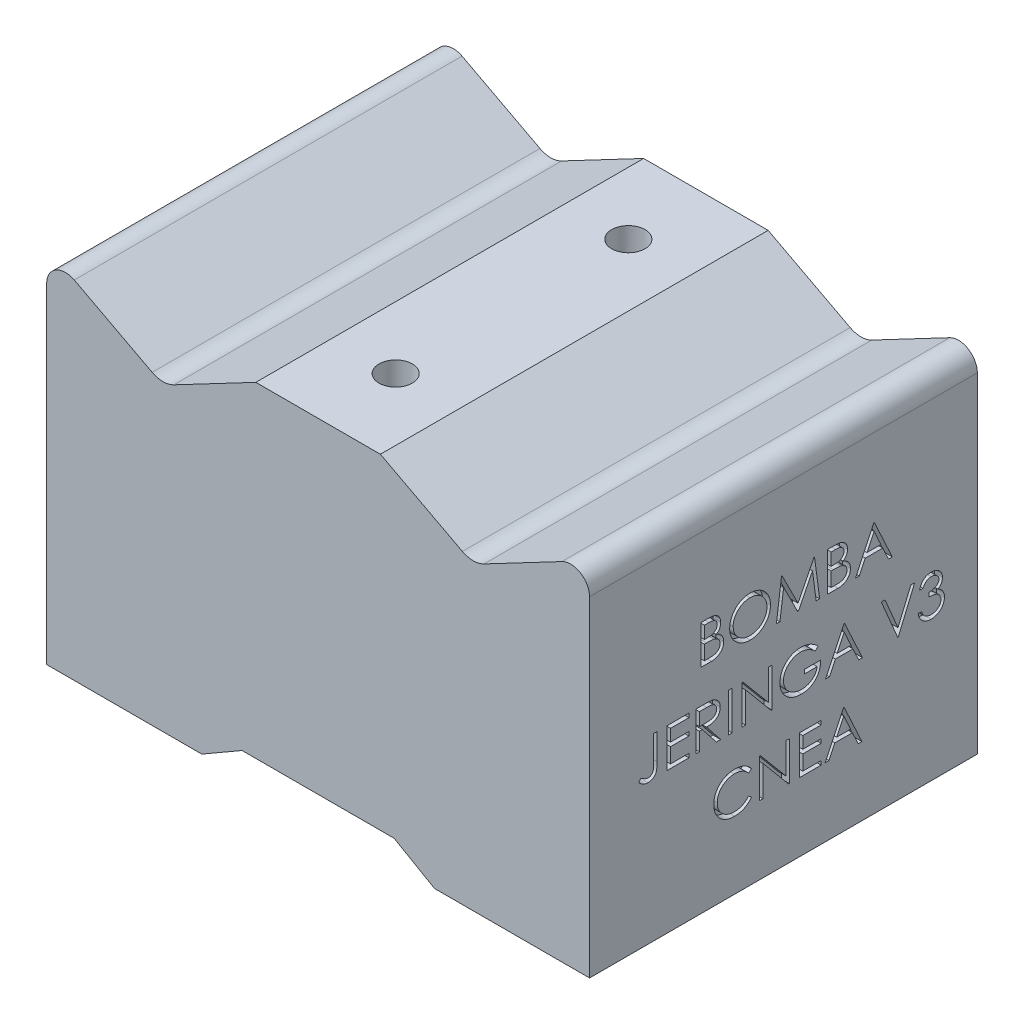
from build123d import *

# Parameters (mm, degrees)
SALIENTE_EXTRUIR1_DEPTH                              = 25
REDONDEO1_R                                          = 3
REDONDEO3_R                                          = 2.429028
REDONDEO1_OF_SIMETR_A1_R                             = 3
REDONDEO3_OF_SIMETR_A1_R                             = 2.429028
DI_METRO_DE_TALADRO_5_5_5_5_1_D                      = 5.5
DI_METRO_DE_TALADRO_5_5_5_5_1_DEPTH                  = 7
TALADRO_DE_MARGEN_PARA_M43_D                         = 5.5
TALADRO_DE_MARGEN_PARA_M43_DEPTH                     = 7
TALADRO_DE_MARGEN_PARA_M43_TIP                       = 2.75
REFRENTADO_PARA_TORNILLO_CON_CABEZA_HUEC_D           = 4.3
REFRENTADO_PARA_TORNILLO_CON_CABEZA_HUEC_CBORE_D     = 8
REFRENTADO_PARA_TORNILLO_CON_CABEZA_HUEC_CBORE_DEPTH = 37.4
CROQUIS28_W                                          = 0.448717949
CROQUIS28_H                                          = 5
CORTAR_EXTRUIR1_DEPTH                                = 1


with BuildPart() as part:
    # Croquis2 → Saliente-Extruir1 (new, symmetric)
    with BuildSketch(Plane.XY):
        Polygon((-35, 45), (-35, 0), (-15, 0), (-9.803847577, 3), (0, 3), (0, 45), (-8.029229647, 45), (-20, 38.699473768), (-31.970770353, 45), align=None)
    saliente_extruir1 = extrude(amount=SALIENTE_EXTRUIR1_DEPTH, both=True)

    # Croquis21 → Diámetro de taladro Ø8.6 (8.6)1 (revolve, cut)
    with BuildSketch(Plane(origin=(-22, 20, -25), x_dir=(0, 1, 0), z_dir=(1, 0, 0))):
        Polygon((0, 0), (0, 16.3), (4.3, 12), (4.3, 0), align=None)
    di_metro_de_taladro_8_6_8_6_1 = revolve(axis=Axis((-22, 20, -31.35), (0, 0, 1)), mode=Mode.SUBTRACT)

    # Redondeo1
    redondeo1_edges = [part.edges().sort_by_distance(p)[0] for p in [
        (-20, 38.699473768, 0),
    ]]
    fillet(redondeo1_edges, radius=REDONDEO1_R)

    # Redondeo3
    redondeo3_edges = [part.edges().sort_by_distance(p)[0] for p in [
        (-35, 45, 0),
        (-31.970770353, 45, 0),
    ]]
    fillet(redondeo3_edges, radius=REDONDEO3_R)

    # Simetría1: Saliente-Extruir1, Diámetro de taladro Ø8.6 (8.6)1 across plane
    add(saliente_extruir1.mirror(Plane(origin=(0, 0, 0), x_dir=(0, 0, 1), z_dir=(1, 0, 0))))
    add(di_metro_de_taladro_8_6_8_6_1.mirror(Plane(origin=(0, 0, 0), x_dir=(0, 0, 1), z_dir=(1, 0, 0))), mode=Mode.SUBTRACT)

    # Redondeo1 of Simetría1
    redondeo1_of_simetr_a1_edges = [part.edges().sort_by_distance(p)[0] for p in [
        (20, 38.699473768, 0),
    ]]
    fillet(redondeo1_of_simetr_a1_edges, radius=REDONDEO1_OF_SIMETR_A1_R)

    # Redondeo3 of Simetría1
    redondeo3_of_simetr_a1_edges = [part.edges().sort_by_distance(p)[0] for p in [
        (35, 45, 0),
        (31.970770353, 45, 0),
    ]]
    fillet(redondeo3_of_simetr_a1_edges, radius=REDONDEO3_OF_SIMETR_A1_R)

    # Diámetro de taladro Ø5.5 (5.5)1
    with Locations(Plane(origin=(0, 0, 0), x_dir=(-1, 0, 0), z_dir=(0, -1, 0))):
        with Locations((25, 15)):
            di_metro_de_taladro_5_5_5_5_1 = Hole(DI_METRO_DE_TALADRO_5_5_5_5_1_D / 2, depth=DI_METRO_DE_TALADRO_5_5_5_5_1_DEPTH)

    # Matriz de croquis1: Diámetro de taladro Ø5.5 (5.5)1 at 3 more places
    with Locations((50, 0, 30), (50, 0, 0), (0, 0, 30)):
        add(di_metro_de_taladro_5_5_5_5_1, mode=Mode.SUBTRACT)

    # Taladro de margen para M43
    with Locations(Plane(origin=(0, 0, -25), x_dir=(-1, 0, 0), z_dir=(0, 0, -1))):
        with Locations((-18.25, 30), (18.25, 30)):
            Hole(TALADRO_DE_MARGEN_PARA_M43_D / 2, depth=TALADRO_DE_MARGEN_PARA_M43_DEPTH)
            with Locations((0, 0, -(TALADRO_DE_MARGEN_PARA_M43_DEPTH + TALADRO_DE_MARGEN_PARA_M43_TIP / 2))):  # 90° drill point
                Cone(0, TALADRO_DE_MARGEN_PARA_M43_D / 2, TALADRO_DE_MARGEN_PARA_M43_TIP, mode=Mode.SUBTRACT)

    # Refrentado para tornillo con cabeza hueca de M41 (through all)
    with Locations(Plane(origin=(0, 3, 0), x_dir=(-1, 0, 0), z_dir=(0, -1, 0))):
        with Locations((0, 15), (0, -15)):
            CounterBoreHole(REFRENTADO_PARA_TORNILLO_CON_CABEZA_HUEC_D / 2, REFRENTADO_PARA_TORNILLO_CON_CABEZA_HUEC_CBORE_D / 2, REFRENTADO_PARA_TORNILLO_CON_CABEZA_HUEC_CBORE_DEPTH)

    # Croquis28 → Cortar-Extruir1 (cut)
    # profile 1 of 18: a face of its own
    with BuildSketch(Plane(origin=(35, 0, 0), x_dir=(0, 0, -1), z_dir=(1, 0, 0))):
        with BuildLine():
            Line((-10.649410219, 32.506300776), (-9.673849322, 32.506300776))
            add(Edge.make_bspline(
                [(-9.673849322, 32.506300776), (-9.626094353, 32.506049704), (-9.533533338, 32.505563064), (-9.398934135, 32.498015734), (-9.272864406, 32.487724777), (-9.155287588, 32.471396073), (-9.046258013, 32.451693534), (-8.945447103, 32.427833797), (-8.853175428, 32.399224349), (-8.743014376, 32.353729662), (-8.617413432, 32.286125135), (-8.481415728, 32.186227185), (-8.365123958, 32.064037952), (-8.26485779, 31.926205587), (-8.185141905, 31.774583056), (-8.12747148, 31.612784215), (-8.09096023, 31.442896012), (-8.087205324, 31.326262901), (-8.085307655, 31.267318404)],
                knots=[0, 0, 0, 0, 1.001505555, 1.941167018, 2.826882275, 3.653841531, 4.429895133, 5.150066043, 5.825578002, 6.45369114, 7.647487171, 8.808567382, 9.977351308, 11.170798116, 12.373658725, 13.556498008, 14.765093433, 16, 16, 16, 16], degree=3))
            add(Edge.make_bspline(
                [(-8.085307655, 31.267318404), (-8.086869395, 31.212100468), (-8.089938363, 31.103592015), (-8.119285162, 30.944886144), (-8.165228974, 30.793812975), (-8.229093616, 30.650923853), (-8.312096468, 30.519447262), (-8.410465494, 30.398322597), (-8.529146641, 30.292678229), (-8.618065555, 30.23361694), (-8.663232334, 30.203616481)],
                knots=[0, 0, 0, 0, 1.044552857, 2.05264487, 3.044412934, 4.028983338, 5.005914585, 5.980388656, 6.974128949, 8, 8, 8, 8], degree=3))
            add(Edge.make_bspline(
                [(-8.663232334, 30.203616481), (-8.606431723, 30.18180934), (-8.497758084, 30.140086876), (-8.348206638, 30.066321928), (-8.219356859, 29.986090342), (-8.110218079, 29.898473413), (-8.016878572, 29.804032255), (-7.93537437, 29.701382091), (-7.86582955, 29.589183866), (-7.806239659, 29.468607387), (-7.759741436, 29.340883861), (-7.724918716, 29.207211323), (-7.704965217, 29.068069102), (-7.702125729, 28.973375702), (-7.70069227, 28.925571609)],
                knots=[0, 0, 0, 0, 1.27268992, 2.434971085, 3.483601985, 4.442670788, 5.356604649, 6.2567628, 7.179492994, 8.113709626, 9.066344395, 10.018646069, 10.999752585, 12, 12, 12, 12], degree=3))
            add(Edge.make_bspline(
                [(-7.70069227, 28.925571609), (-7.702087765, 28.876761792), (-7.704833439, 28.780727109), (-7.725090541, 28.639648345), (-7.759389266, 28.504826993), (-7.80663376, 28.375391018), (-7.86829421, 28.251590826), (-7.943334159, 28.133286163), (-8.032807821, 28.021665691), (-8.132897634, 27.915489086), (-8.24612927, 27.820020819), (-8.368294635, 27.73499838), (-8.500932234, 27.665075435), (-8.641863654, 27.606338261), (-8.79266982, 27.561470835), (-8.952673545, 27.530081443), (-9.121736833, 27.50893139), (-9.237750764, 27.507192526), (-9.297246757, 27.506300776)],
                knots=[0, 0, 0, 0, 0.978564426, 1.925352924, 2.850884081, 3.763762016, 4.682927383, 5.618979971, 6.567305752, 7.547517671, 8.540179244, 9.531824382, 10.526200242, 11.540722885, 12.589160233, 13.674978461, 14.80764778, 16, 16, 16, 16], degree=3))
            Line((-9.297246757, 27.506300776), (-10.649410219, 27.506300776))
            Line((-10.649410219, 27.506300776), (-10.649410219, 32.506300776))
        make_face()
        with BuildLine():
            Line((-10.20069227, 31.993480263), (-10.20069227, 30.390916161))
            Line((-10.20069227, 30.390916161), (-9.899209898, 30.390916161))
            add(Edge.make_bspline(
                [(-9.899209898, 30.390916161), (-9.855140191, 30.391487479), (-9.769988535, 30.392591383), (-9.646674397, 30.39575355), (-9.532210085, 30.404607898), (-9.426793181, 30.413459701), (-9.330589689, 30.427851969), (-9.243812744, 30.444983573), (-9.165100463, 30.463102009), (-9.074329684, 30.493915562), (-8.971368329, 30.539455098), (-8.861606751, 30.61012915), (-8.764843223, 30.694306797), (-8.683132955, 30.791436742), (-8.616259426, 30.898388436), (-8.569811261, 31.013455408), (-8.538315141, 31.133769883), (-8.535470096, 31.216367387), (-8.534025604, 31.258303981)],
                knots=[0, 0, 0, 0, 1.156816544, 2.235205308, 3.236616184, 4.169592532, 5.011045266, 5.787822928, 6.49130361, 7.128639758, 8.301311294, 9.436451833, 10.541879658, 11.654887649, 12.756523258, 13.837046038, 14.901820046, 16, 16, 16, 16], degree=3))
            add(Edge.make_bspline(
                [(-8.534025604, 31.258303981), (-8.53477729, 31.286055083), (-8.536251804, 31.340491901), (-8.54832795, 31.419848121), (-8.568853057, 31.494482053), (-8.595216333, 31.565416496), (-8.632057317, 31.630433425), (-8.675433693, 31.691780848), (-8.727841822, 31.747369588), (-8.787495125, 31.799326015), (-8.856078872, 31.845389626), (-8.933552146, 31.885733573), (-9.020963114, 31.918220397), (-9.116838621, 31.946672043), (-9.22265446, 31.96665532), (-9.337189536, 31.983303017), (-9.461381992, 31.991778363), (-9.547303567, 31.99290031), (-9.591717911, 31.993480263)],
                knots=[0, 0, 0, 0, 0.91205012, 1.789085906, 2.630437955, 3.453916878, 4.269457761, 5.079663411, 5.91843418, 6.774407191, 7.675494373, 8.627863946, 9.638891023, 10.736472738, 11.911756761, 13.175263542, 14.539845004, 16, 16, 16, 16], degree=3))
            Line((-9.591717911, 31.993480263), (-10.20069227, 31.993480263))
        make_face(mode=Mode.SUBTRACT)
        with BuildLine():
            Line((-10.20069227, 29.878095648), (-10.20069227, 28.019121289))
            Line((-10.20069227, 28.019121289), (-9.561669834, 28.019121289))
            add(Edge.make_bspline(
                [(-9.561669834, 28.019121289), (-9.515928512, 28.0196695), (-9.427768142, 28.020726103), (-9.300480671, 28.024175467), (-9.182504808, 28.032021575), (-9.0743789, 28.044372789), (-8.974935396, 28.057770573), (-8.885367249, 28.075786689), (-8.804948401, 28.096428061), (-8.71169939, 28.128334021), (-8.606694378, 28.177900408), (-8.493536012, 28.252635018), (-8.392927129, 28.341668314), (-8.307491044, 28.444712477), (-8.237472489, 28.55675723), (-8.186536125, 28.675536302), (-8.155120615, 28.799087055), (-8.151317516, 28.883325216), (-8.149410219, 28.925571609)],
                knots=[0, 0, 0, 0, 1.160039823, 2.235823828, 3.228722157, 4.157150951, 4.99529583, 5.772374946, 6.472645482, 7.099169577, 8.269452708, 9.405989375, 10.527446681, 11.663510218, 12.788923519, 13.866172445, 14.929861265, 16, 16, 16, 16], degree=3))
            add(Edge.make_bspline(
                [(-8.149410219, 28.925571609), (-8.149804654, 28.951990667), (-8.150587161, 29.004402641), (-8.162388039, 29.08142524), (-8.179550711, 29.156033631), (-8.201738473, 29.228430403), (-8.234051998, 29.297306655), (-8.271775633, 29.364024597), (-8.316006207, 29.428672425), (-8.384926444, 29.510404215), (-8.485172136, 29.604571377), (-8.627610387, 29.696767808), (-8.789570813, 29.771121818), (-8.90703866, 29.802692499), (-8.967719514, 29.819001097)],
                knots=[0, 0, 0, 0, 0.723448775, 1.435228256, 2.130040452, 2.821711965, 3.505591119, 4.210454504, 4.921174351, 5.648778258, 7.137944449, 8.670945889, 10.280296675, 12, 12, 12, 12], degree=3))
            add(Edge.make_bspline(
                [(-8.967719514, 29.819001097), (-8.992046794, 29.823936931), (-9.044793354, 29.834638838), (-9.130804183, 29.845935557), (-9.228998282, 29.855999928), (-9.339602392, 29.863444439), (-9.462756451, 29.871139501), (-9.598723477, 29.874132103), (-9.746948213, 29.877702474), (-9.849794459, 29.877961237), (-9.903216309, 29.878095648)],
                knots=[0, 0, 0, 0, 0.634451884, 1.375622551, 2.216452059, 3.157844607, 4.20941857, 5.370758133, 6.634282058, 8, 8, 8, 8], degree=3))
            Line((-9.903216309, 29.878095648), (-10.20069227, 29.878095648))
        make_face(mode=Mode.SUBTRACT)
    # profile 2 of 18: a face of its own
    with BuildSketch(Plane(origin=(35, 0, 0), x_dir=(0, 0, -1), z_dir=(1, 0, 0))):
        with BuildLine():
            add(Edge.make_bspline(
                [(-4.335307655, 32.634505904), (-4.242724646, 32.632160934), (-4.060883979, 32.627555218), (-3.793634125, 32.592299356), (-3.538498275, 32.531305942), (-3.293398077, 32.45007311), (-3.061265253, 32.341709702), (-2.84035255, 32.210730919), (-2.631185587, 32.055764549), (-2.436583613, 31.878008511), (-2.258502256, 31.684603576), (-2.101608133, 31.478206562), (-1.970119141, 31.260065416), (-1.862139446, 31.030835658), (-1.777427146, 30.791035704), (-1.718971369, 30.539387128), (-1.681631155, 30.277520428), (-1.677265758, 30.098910621), (-1.675051245, 30.008303981)],
                knots=[0, 0, 0, 0, 1.065120563, 2.091984664, 3.0946048, 4.079830382, 5.057816894, 6.036188127, 7.030412546, 8.04752943, 9.064399622, 10.05169764, 11.02544977, 11.989514704, 12.962713494, 13.945757189, 14.957906945, 16, 16, 16, 16], degree=3))
            add(Edge.make_bspline(
                [(-1.675051245, 30.008303981), (-1.677265434, 29.918364772), (-1.681629858, 29.741084172), (-1.719013825, 29.480879251), (-1.777643825, 29.230749685), (-1.861352777, 28.991113038), (-1.968817746, 28.761716518), (-2.101182277, 28.543163727), (-2.257098292, 28.335383015), (-2.434536651, 28.140650636), (-2.627966711, 27.962082821), (-2.83543852, 27.806484427), (-3.05228612, 27.672592821), (-3.281299989, 27.565759001), (-3.519442899, 27.480370543), (-3.768846217, 27.4221525), (-4.028341295, 27.384599581), (-4.205299871, 27.380287415), (-4.295243552, 27.378095648)],
                knots=[0, 0, 0, 0, 1.043624062, 2.057103931, 3.04512605, 4.022047818, 4.998200453, 5.980619268, 6.982898556, 8.009068085, 9.034988726, 10.034168286, 11.015286542, 11.987931943, 12.962482838, 13.94673481, 14.956375938, 16, 16, 16, 16], degree=3))
            add(Edge.make_bspline(
                [(-4.295243552, 27.378095648), (-4.385849722, 27.380309058), (-4.564458602, 27.384672278), (-4.826654367, 27.422074284), (-5.078479715, 27.480561861), (-5.319214503, 27.56414677), (-5.548992974, 27.672171386), (-5.76826452, 27.803891927), (-5.976149016, 27.960187843), (-6.17092294, 28.137568664), (-6.34913608, 28.330670881), (-6.504506617, 28.53757696), (-6.636256779, 28.754227612), (-6.743918682, 28.981224075), (-6.829153624, 29.217468993), (-6.887303364, 29.464538247), (-6.924926153, 29.721023255), (-6.929261648, 29.895655967), (-6.931461501, 29.98426552)],
                knots=[0, 0, 0, 0, 1.053102029, 2.075944431, 3.073151272, 4.055350789, 5.033113405, 6.020478099, 7.024410459, 8.052272461, 9.079885166, 10.07527673, 11.055994387, 12.023226415, 12.992069828, 13.970394897, 14.97016774, 16, 16, 16, 16], degree=3))
            add(Edge.make_bspline(
                [(-6.931461501, 29.98426552), (-6.930697736, 30.043740761), (-6.929179841, 30.161940938), (-6.910905995, 30.337464652), (-6.884389279, 30.510165592), (-6.846386547, 30.67955266), (-6.796684165, 30.84521121), (-6.738038412, 31.008283728), (-6.666410061, 31.167117619), (-6.585437707, 31.322465322), (-6.495063695, 31.471905187), (-6.395241196, 31.613161735), (-6.289476384, 31.747420302), (-6.173528679, 31.871201736), (-6.051219472, 31.988106959), (-5.920564646, 32.096339412), (-5.782361439, 32.196875056), (-5.636015183, 32.287475543), (-5.485131933, 32.369417164), (-5.329593679, 32.439734094), (-5.171512862, 32.500085611), (-5.01014908, 32.549001075), (-4.845930834, 32.58761827), (-4.678499713, 32.613914489), (-4.507989104, 32.632234943), (-4.393115791, 32.63374566), (-4.335307655, 32.634505904)],
                knots=[0, 0, 0, 0, 1.037015668, 2.060948919, 3.074880161, 4.083647147, 5.086022904, 6.090072063, 7.104153813, 8.122640571, 9.144368836, 10.147691507, 11.138137339, 12.123020368, 13.103399296, 14.087645067, 15.080126199, 16.082011238, 17.087798457, 18.072939717, 19.057185487, 20.037253025, 21.01195951, 21.997135196, 22.992090687, 24, 24, 24, 24], degree=3))
        make_face()
        with BuildLine():
            add(Edge.make_bspline(
                [(-4.313272398, 32.121685392), (-4.360721875, 32.121106977), (-4.455167208, 32.119955677), (-4.595573688, 32.104790369), (-4.734133594, 32.083176242), (-4.870875539, 32.052345498), (-5.005227381, 32.010339709), (-5.13844144, 31.961995554), (-5.269302946, 31.903108282), (-5.397379886, 31.836575847), (-5.521544279, 31.762934531), (-5.638705281, 31.681546293), (-5.749166201, 31.594319787), (-5.852656582, 31.501051448), (-5.948872542, 31.401266302), (-6.03970783, 31.296477108), (-6.121521518, 31.183688692), (-6.196500913, 31.065959539), (-6.263597828, 30.943442995), (-6.32326262, 30.817428906), (-6.372068347, 30.686889353), (-6.411871742, 30.553240557), (-6.444871472, 30.416694186), (-6.465777078, 30.276214402), (-6.48110902, 30.132507099), (-6.482194513, 30.035390164), (-6.482743552, 29.986268725)],
                knots=[0, 0, 0, 0, 1.008559885, 2.007477868, 2.99961109, 3.989939068, 4.984837346, 5.991145699, 7.001802488, 8.033829008, 9.059044045, 10.069351652, 11.065060232, 12.050310815, 13.029377138, 14.011219647, 14.996725999, 15.989392538, 16.977580475, 17.965360261, 18.951710183, 19.937753436, 20.929683414, 21.935841486, 22.955955122, 24, 24, 24, 24], degree=3))
            add(Edge.make_bspline(
                [(-6.482743552, 29.986268725), (-6.480922321, 29.914036981), (-6.477339395, 29.771934795), (-6.445971438, 29.563694589), (-6.397654332, 29.363568466), (-6.326429523, 29.172651453), (-6.237357216, 28.989302477), (-6.127318801, 28.815148042), (-5.996948679, 28.650141078), (-5.848857927, 28.495433551), (-5.686968346, 28.35422526), (-5.515064446, 28.230277533), (-5.334987864, 28.125405747), (-5.146269003, 28.03996993), (-4.949915376, 27.972270304), (-4.744661731, 27.92587226), (-4.53187536, 27.895335895), (-4.386831567, 27.892403387), (-4.313272398, 27.890916161)],
                knots=[0, 0, 0, 0, 1.032063989, 2.030389145, 3.003944642, 3.970395727, 4.937377036, 5.913328081, 6.909231446, 7.93887556, 8.970685674, 9.976071282, 10.964166581, 11.944589148, 12.933237628, 13.927779006, 14.949070134, 16, 16, 16, 16], degree=3))
            add(Edge.make_bspline(
                [(-4.313272398, 27.890916161), (-4.263830253, 27.891595453), (-4.16577163, 27.892942693), (-4.019920884, 27.906512231), (-3.876697724, 27.928272044), (-3.736303039, 27.959601552), (-3.598896165, 27.998811847), (-3.463903589, 28.045394316), (-3.332763174, 28.103510321), (-3.203820549, 28.167721681), (-3.080397347, 28.240921906), (-2.962575158, 28.319547834), (-2.853323758, 28.406645863), (-2.749910799, 28.498528453), (-2.653299814, 28.597048235), (-2.564144123, 28.702077124), (-2.482743934, 28.814278062), (-2.40779301, 28.931828642), (-2.340931206, 29.054680432), (-2.28267535, 29.1811514), (-2.233252328, 29.310930128), (-2.193354464, 29.444203801), (-2.162089518, 29.5807193), (-2.140546776, 29.720659411), (-2.125477578, 29.863744186), (-2.124341753, 29.960521123), (-2.123769193, 30.009305584)],
                knots=[0, 0, 0, 0, 1.047197238, 2.076906641, 3.100256066, 4.114471768, 5.12198147, 6.126382909, 7.136867548, 8.15857795, 9.17633901, 10.174870724, 11.156907918, 12.133735059, 13.104061851, 14.077631395, 15.04955518, 16.038496417, 17.029181396, 18.010275684, 18.986308667, 19.968651475, 20.955262928, 21.950658345, 22.966943676, 24, 24, 24, 24], degree=3))
            add(Edge.make_bspline(
                [(-2.123769193, 30.009305584), (-2.124342212, 30.057756304), (-2.1254789, 30.153867233), (-2.140539578, 30.295954116), (-2.162112278, 30.434887276), (-2.193201861, 30.57012128), (-2.233273509, 30.701690601), (-2.282683981, 30.82947167), (-2.340948695, 30.95394052), (-2.407817587, 31.074789515), (-2.482983049, 31.190753427), (-2.565117682, 31.301614016), (-2.655639608, 31.405289361), (-2.751962501, 31.504338924), (-2.856492337, 31.596650195), (-2.968755614, 31.682253796), (-3.08738944, 31.763215616), (-3.212999776, 31.836252133), (-3.342633996, 31.903701037), (-3.475653936, 31.961488184), (-3.610552649, 32.010591212), (-3.746987095, 32.05247259), (-3.886105636, 32.083055491), (-4.026968249, 32.104809848), (-4.169380047, 32.119950399), (-4.265156075, 32.121105225), (-4.313272398, 32.121685392)],
                knots=[0, 0, 0, 0, 1.02996197, 2.043119294, 3.035359645, 4.018872909, 4.991431989, 5.957985074, 6.929999688, 7.912076566, 8.892894881, 9.867085534, 10.843653904, 11.817741046, 12.803660682, 13.806313499, 14.818574707, 15.856120519, 16.894564902, 17.924820532, 18.937903209, 19.946497019, 20.957711757, 21.963978472, 22.977135795, 24, 24, 24, 24], degree=3))
        make_face(mode=Mode.SUBTRACT)
    # profile 3 of 18: a face of its own
    with BuildSketch(Plane(origin=(35, 0, 0), x_dir=(0, 0, -1), z_dir=(1, 0, 0))):
        Polygon((-0.905820475, 27.506300776), (-0.245764386, 32.506300776), (-0.181661822, 32.506300776), (1.882641063, 28.403736674), (3.941935935, 32.506300776), (4.007040102, 32.506300776), (4.671102602, 27.506300776), (4.220381448, 27.506300776), (3.741615422, 31.104057186), (1.936727602, 27.506300776), (1.835565743, 27.506300776), (0.023666704, 31.112070007), (-0.454097719, 27.506300776), align=None)
    # profile 4 of 18: a face of its own
    with BuildSketch(Plane(origin=(35, 0, 0), x_dir=(0, 0, -1), z_dir=(1, 0, 0))):
        with BuildLine():
            Line((5.696743627, 32.506300776), (6.672304525, 32.506300776))
            add(Edge.make_bspline(
                [(6.672304525, 32.506300776), (6.720059493, 32.506049704), (6.812620508, 32.505563064), (6.947219711, 32.498015734), (7.07328944, 32.487724777), (7.190866258, 32.471396073), (7.299895833, 32.451693534), (7.400706743, 32.427833797), (7.492978418, 32.399224349), (7.60313947, 32.353729662), (7.728740414, 32.286125135), (7.864738118, 32.186227185), (7.981029888, 32.064037952), (8.081296056, 31.926205587), (8.161011941, 31.774583056), (8.218682366, 31.612784215), (8.255193616, 31.442896012), (8.258948522, 31.326262901), (8.260846191, 31.267318404)],
                knots=[0, 0, 0, 0, 1.001505555, 1.941167018, 2.826882275, 3.653841531, 4.429895133, 5.150066043, 5.825578002, 6.45369114, 7.647487171, 8.808567382, 9.977351308, 11.170798116, 12.373658725, 13.556498008, 14.765093433, 16, 16, 16, 16], degree=3))
            add(Edge.make_bspline(
                [(8.260846191, 31.267318404), (8.259284451, 31.212100468), (8.256215483, 31.103592015), (8.226868684, 30.944886144), (8.180924872, 30.793812975), (8.11706023, 30.650923853), (8.034057379, 30.519447262), (7.935688352, 30.398322597), (7.817007205, 30.292678229), (7.728088291, 30.23361694), (7.682921512, 30.203616481)],
                knots=[0, 0, 0, 0, 1.044552857, 2.05264487, 3.044412934, 4.028983338, 5.005914585, 5.980388656, 6.974128949, 8, 8, 8, 8], degree=3))
            add(Edge.make_bspline(
                [(7.682921512, 30.203616481), (7.739722123, 30.18180934), (7.848395762, 30.140086876), (7.997947208, 30.066321928), (8.126796987, 29.986090342), (8.235935767, 29.898473413), (8.329275274, 29.804032255), (8.410779476, 29.701382091), (8.480324296, 29.589183866), (8.539914187, 29.468607387), (8.58641241, 29.340883861), (8.62123513, 29.207211323), (8.641188629, 29.068069102), (8.644028117, 28.973375702), (8.645461576, 28.925571609)],
                knots=[0, 0, 0, 0, 1.27268992, 2.434971085, 3.483601985, 4.442670788, 5.356604649, 6.2567628, 7.179492994, 8.113709626, 9.066344395, 10.018646069, 10.999752585, 12, 12, 12, 12], degree=3))
            add(Edge.make_bspline(
                [(8.645461576, 28.925571609), (8.644066082, 28.876761792), (8.641320407, 28.780727109), (8.621063305, 28.639648345), (8.586764581, 28.504826993), (8.539520086, 28.375391018), (8.477859636, 28.251590826), (8.402819687, 28.133286163), (8.313346025, 28.021665691), (8.213256212, 27.915489086), (8.100024576, 27.820020819), (7.977859212, 27.73499838), (7.845221612, 27.665075435), (7.704290192, 27.606338261), (7.553484026, 27.561470835), (7.393480301, 27.530081443), (7.224417013, 27.50893139), (7.108403083, 27.507192526), (7.048907089, 27.506300776)],
                knots=[0, 0, 0, 0, 0.978564426, 1.925352924, 2.850884081, 3.763762016, 4.682927383, 5.618979971, 6.567305752, 7.547517671, 8.540179244, 9.531824382, 10.526200242, 11.540722885, 12.589160233, 13.674978461, 14.80764778, 16, 16, 16, 16], degree=3))
            Line((7.048907089, 27.506300776), (5.696743627, 27.506300776))
            Line((5.696743627, 27.506300776), (5.696743627, 32.506300776))
        make_face()
        with BuildLine():
            Line((6.145461576, 31.993480263), (6.145461576, 30.390916161))
            Line((6.145461576, 30.390916161), (6.446943948, 30.390916161))
            add(Edge.make_bspline(
                [(6.446943948, 30.390916161), (6.491013655, 30.391487479), (6.576165311, 30.392591383), (6.699479449, 30.39575355), (6.813943761, 30.404607898), (6.919360665, 30.413459701), (7.015564157, 30.427851969), (7.102341102, 30.444983573), (7.181053383, 30.463102009), (7.271824163, 30.493915562), (7.374785518, 30.539455098), (7.484547095, 30.61012915), (7.581310623, 30.694306797), (7.663020891, 30.791436742), (7.72989442, 30.898388436), (7.776342585, 31.013455408), (7.807838705, 31.133769883), (7.81068375, 31.216367387), (7.812128243, 31.258303981)],
                knots=[0, 0, 0, 0, 1.156816544, 2.235205308, 3.236616184, 4.169592532, 5.011045266, 5.787822928, 6.49130361, 7.128639758, 8.301311294, 9.436451833, 10.541879658, 11.654887649, 12.756523258, 13.837046038, 14.901820046, 16, 16, 16, 16], degree=3))
            add(Edge.make_bspline(
                [(7.812128243, 31.258303981), (7.811376557, 31.286055083), (7.809902042, 31.340491901), (7.797825896, 31.419848121), (7.77730079, 31.494482053), (7.750937514, 31.565416496), (7.71409653, 31.630433425), (7.670720153, 31.691780848), (7.618312025, 31.747369588), (7.558658721, 31.799326015), (7.490074974, 31.845389626), (7.4126017, 31.885733573), (7.325190732, 31.918220397), (7.229315225, 31.946672043), (7.123499386, 31.96665532), (7.00896431, 31.983303017), (6.884771854, 31.991778363), (6.798850279, 31.99290031), (6.754435935, 31.993480263)],
                knots=[0, 0, 0, 0, 0.91205012, 1.789085906, 2.630437955, 3.453916878, 4.269457761, 5.079663411, 5.91843418, 6.774407191, 7.675494373, 8.627863946, 9.638891023, 10.736472738, 11.911756761, 13.175263542, 14.539845004, 16, 16, 16, 16], degree=3))
            Line((6.754435935, 31.993480263), (6.145461576, 31.993480263))
        make_face(mode=Mode.SUBTRACT)
        with BuildLine():
            Line((6.145461576, 29.878095648), (6.145461576, 28.019121289))
            Line((6.145461576, 28.019121289), (6.784484012, 28.019121289))
            add(Edge.make_bspline(
                [(6.784484012, 28.019121289), (6.830225335, 28.0196695), (6.918385704, 28.020726103), (7.045673176, 28.024175467), (7.163649038, 28.032021575), (7.271774946, 28.044372789), (7.37121845, 28.057770573), (7.460786597, 28.075786689), (7.541205445, 28.096428061), (7.634454456, 28.128334021), (7.739459468, 28.177900408), (7.852617834, 28.252635018), (7.953226717, 28.341668314), (8.038662802, 28.444712477), (8.108681357, 28.55675723), (8.159617721, 28.675536302), (8.191033231, 28.799087055), (8.19483633, 28.883325216), (8.196743627, 28.925571609)],
                knots=[0, 0, 0, 0, 1.160039823, 2.235823828, 3.228722157, 4.157150951, 4.99529583, 5.772374946, 6.472645482, 7.099169577, 8.269452708, 9.405989375, 10.527446681, 11.663510218, 12.788923519, 13.866172445, 14.929861265, 16, 16, 16, 16], degree=3))
            add(Edge.make_bspline(
                [(8.196743627, 28.925571609), (8.196349192, 28.951990667), (8.195566685, 29.004402641), (8.183765807, 29.08142524), (8.166603136, 29.156033631), (8.144415373, 29.228430403), (8.112101848, 29.297306655), (8.074378213, 29.364024597), (8.030147639, 29.428672425), (7.961227402, 29.510404215), (7.86098171, 29.604571377), (7.718543459, 29.696767808), (7.556583034, 29.771121818), (7.439115187, 29.802692499), (7.378434332, 29.819001097)],
                knots=[0, 0, 0, 0, 0.723448775, 1.435228256, 2.130040452, 2.821711965, 3.505591119, 4.210454504, 4.921174351, 5.648778258, 7.137944449, 8.670945889, 10.280296675, 12, 12, 12, 12], degree=3))
            add(Edge.make_bspline(
                [(7.378434332, 29.819001097), (7.354107053, 29.823936931), (7.301360492, 29.834638838), (7.215349663, 29.845935557), (7.117155564, 29.855999928), (7.006551454, 29.863444439), (6.883397395, 29.871139501), (6.747430369, 29.874132103), (6.599205633, 29.877702474), (6.496359387, 29.877961237), (6.442937537, 29.878095648)],
                knots=[0, 0, 0, 0, 0.634451884, 1.375622551, 2.216452059, 3.157844607, 4.20941857, 5.370758133, 6.634282058, 8, 8, 8, 8], degree=3))
            Line((6.442937537, 29.878095648), (6.145461576, 29.878095648))
        make_face(mode=Mode.SUBTRACT)
    # profile 5 of 18: a face of its own
    with BuildSketch(Plane(origin=(35, 0, 0), x_dir=(0, 0, -1), z_dir=(1, 0, 0))):
        Polygon((11.722384653, 32.506300776), (14.030076961, 27.506300776), (13.542296512, 27.506300776), (12.80311382, 29.108864879), (10.536487217, 29.108864879), (9.776270871, 27.506300776), (9.286487217, 27.506300776), (11.658282089, 32.506300776), align=None)
        Polygon((11.685325358, 31.531741481), (10.77987664, 29.621685392), (12.566735614, 29.621685392), align=None, mode=Mode.SUBTRACT)
    # profile 6 of 18: a face of its own
    with BuildSketch(Plane(origin=(35, 0, 0), x_dir=(0, 0, -1), z_dir=(1, 0, 0))):
        with BuildLine():
            Line((-16.739153809, 23.172967443), (-16.29043586, 23.172967443))
            Line((-16.29043586, 23.172967443), (-16.29043586, 19.796565199))
            add(Edge.make_bspline(
                [(-16.29043586, 19.796565199), (-16.290884315, 19.734129241), (-16.291745404, 19.614244582), (-16.296480276, 19.441567588), (-16.305242387, 19.283895179), (-16.318006691, 19.140868826), (-16.335035595, 19.012936604), (-16.354522778, 18.899110007), (-16.37811249, 18.800339033), (-16.413636014, 18.689431382), (-16.471884512, 18.567797375), (-16.559551709, 18.436432874), (-16.668455704, 18.321528002), (-16.794600037, 18.221738395), (-16.939087214, 18.142228064), (-17.098941813, 18.085149238), (-17.273179795, 18.050333729), (-17.394035813, 18.046656721), (-17.456301245, 18.044762315)],
                knots=[0, 0, 0, 0, 1.237770943, 2.376671248, 3.424123796, 4.367912054, 5.222547132, 5.982086412, 6.656319012, 7.234008312, 8.288027371, 9.317870876, 10.352700517, 11.413286737, 12.494591526, 13.606319346, 14.766767577, 16, 16, 16, 16], degree=3))
            add(Edge.make_bspline(
                [(-17.456301245, 18.044762315), (-17.504813185, 18.046306042), (-17.602422422, 18.049412124), (-17.747694863, 18.074728856), (-17.892554829, 18.113751776), (-18.037771184, 18.17089834), (-18.186212958, 18.248620624), (-18.339890596, 18.350313219), (-18.500780868, 18.475786828), (-18.606756991, 18.571555036), (-18.662230732, 18.621685392)],
                knots=[0, 0, 0, 0, 0.848567217, 1.707373443, 2.573483905, 3.470863513, 4.432650262, 5.500696352, 6.691726801, 8, 8, 8, 8], degree=3))
            Line((-18.662230732, 18.621685392), (-18.397807655, 19.006300776))
            add(Edge.make_bspline(
                [(-18.397807655, 19.006300776), (-18.336803828, 18.964233067), (-18.221620648, 18.884803748), (-18.052328589, 18.78262289), (-17.902332656, 18.695015511), (-17.80421416, 18.650369398), (-17.758785219, 18.629698212)],
                knots=[0, 0, 0, 0, 1.196737151, 2.259595785, 3.194191475, 4, 4, 4, 4], degree=3))
            add(Edge.make_bspline(
                [(-17.758785219, 18.629698212), (-17.731236202, 18.618898987), (-17.677206446, 18.597719303), (-17.59459919, 18.574082305), (-17.512463423, 18.561164577), (-17.458009574, 18.558762672), (-17.43126118, 18.557582827)],
                knots=[0, 0, 0, 0, 1.051806502, 2.062826769, 3.048436908, 4, 4, 4, 4], degree=3))
            add(Edge.make_bspline(
                [(-17.43126118, 18.557582827), (-17.39671434, 18.559043877), (-17.328427974, 18.561931834), (-17.229193697, 18.587430799), (-17.134253652, 18.626351375), (-17.047011284, 18.683338937), (-16.966603588, 18.75109811), (-16.900256694, 18.833035265), (-16.844946345, 18.923843813), (-16.811661069, 19.009803033), (-16.790454252, 19.088198219), (-16.776994785, 19.160245556), (-16.76522527, 19.24447624), (-16.75496591, 19.340990812), (-16.748959524, 19.4499825), (-16.742220562, 19.571131276), (-16.739784475, 19.704742579), (-16.739370446, 19.797901082), (-16.739153809, 19.846645327)],
                knots=[0, 0, 0, 0, 0.997221856, 1.971139923, 2.944579524, 3.951425367, 4.971190333, 5.972282193, 6.985401279, 8.033996657, 8.624075553, 9.332086008, 10.151144245, 11.082816738, 12.137127781, 13.306538797, 14.590673636, 16, 16, 16, 16], degree=3))
            Line((-16.739153809, 19.846645327), (-16.739153809, 23.172967443))
        make_face()
    # profile 7 of 18: a face of its own
    with BuildSketch(Plane(origin=(35, 0, 0), x_dir=(0, 0, -1), z_dir=(1, 0, 0))):
        Polygon((-15.008384578, 23.172967443), (-12.187871757, 23.172967443), (-12.187871757, 22.66014693), (-14.559666629, 22.66014693), (-14.559666629, 21.121685392), (-12.187871757, 21.121685392), (-12.187871757, 20.608864879), (-14.559666629, 20.608864879), (-14.559666629, 18.685787956), (-12.187871757, 18.685787956), (-12.187871757, 18.172967443), (-15.008384578, 18.172967443), align=None)
    # profile 8 of 18: a face of its own
    with BuildSketch(Plane(origin=(35, 0, 0), x_dir=(0, 0, -1), z_dir=(1, 0, 0))):
        with BuildLine():
            Line((-11.29043586, 23.172967443), (-10.289834898, 23.172967443))
            add(Edge.make_bspline(
                [(-10.289834898, 23.172967443), (-10.223061858, 23.172745177), (-10.094850223, 23.172318402), (-9.911174122, 23.169938741), (-9.744278269, 23.163118233), (-9.594249928, 23.157248828), (-9.461091849, 23.146546055), (-9.344395719, 23.136316559), (-9.244699009, 23.122925615), (-9.184347793, 23.110489296), (-9.157022398, 23.104858468)],
                knots=[0, 0, 0, 0, 1.410062039, 2.707475311, 3.878576406, 4.937260626, 5.877586885, 6.699081471, 7.410979367, 8, 8, 8, 8], degree=3))
            add(Edge.make_bspline(
                [(-9.157022398, 23.104858468), (-9.120441507, 23.095820232), (-9.048060093, 23.07793657), (-8.943845713, 23.04013714), (-8.844539536, 22.996394819), (-8.750554073, 22.945018076), (-8.662360085, 22.885625533), (-8.579048213, 22.819242501), (-8.500240408, 22.746232207), (-8.429123793, 22.664753862), (-8.362068005, 22.579273134), (-8.305512825, 22.486839196), (-8.256760711, 22.390179871), (-8.217945686, 22.288312131), (-8.186691439, 22.182223886), (-8.164653954, 22.070954176), (-8.151437971, 21.955009926), (-8.150092464, 21.875927199), (-8.149410219, 21.83582802)],
                knots=[0, 0, 0, 0, 1.027469482, 2.033020251, 3.019912614, 3.986113645, 4.951240523, 5.91722682, 6.890402269, 7.87763091, 8.8651537, 9.85103654, 10.82876324, 11.815024772, 12.821070561, 13.842952187, 14.906261191, 16, 16, 16, 16], degree=3))
            add(Edge.make_bspline(
                [(-8.149410219, 21.83582802), (-8.151508788, 21.769206442), (-8.155603639, 21.639210488), (-8.193782358, 21.450552086), (-8.256320244, 21.27456735), (-8.342496371, 21.111477868), (-8.452238479, 20.96446266), (-8.584131038, 20.835333438), (-8.738247626, 20.72727642), (-8.881718077, 20.652343842), (-9.008452648, 20.604353972), (-9.112785952, 20.570587746), (-9.22659592, 20.544499224), (-9.348792112, 20.521127607), (-9.479883048, 20.503482329), (-9.619554533, 20.490558623), (-9.767906178, 20.48248141), (-9.869819135, 20.481278546), (-9.922246757, 20.48065975)],
                knots=[0, 0, 0, 0, 1.260483769, 2.459530307, 3.627416485, 4.787058657, 5.939039949, 7.08810263, 8.267026773, 9.491475466, 10.141966685, 10.831826277, 11.566392101, 12.351337768, 13.187381173, 14.07005841, 15.007169909, 16, 16, 16, 16], degree=3))
            Line((-9.922246757, 20.48065975), (-8.085307655, 18.172967443))
            Line((-8.085307655, 18.172967443), (-8.640195475, 18.172967443))
            Line((-8.640195475, 18.172967443), (-10.477134578, 20.48065975))
            Line((-10.477134578, 20.48065975), (-10.841717911, 20.48065975))
            Line((-10.841717911, 20.48065975), (-10.841717911, 18.172967443))
            Line((-10.841717911, 18.172967443), (-11.29043586, 18.172967443))
            Line((-11.29043586, 18.172967443), (-11.29043586, 23.172967443))
        make_face()
        with BuildLine():
            Line((-10.841717911, 22.66014693), (-10.841717911, 20.993480263))
            Line((-10.841717911, 20.993480263), (-9.926253168, 20.986469045))
            add(Edge.make_bspline(
                [(-9.926253168, 20.986469045), (-9.883510255, 20.986450136), (-9.800662316, 20.986413484), (-9.680804224, 20.992118878), (-9.569204064, 20.998609333), (-9.466288704, 21.00853697), (-9.372012168, 21.021331358), (-9.286421577, 21.037335621), (-9.209377217, 21.055981425), (-9.119522163, 21.08484089), (-9.019184261, 21.130563773), (-8.910139318, 21.197085914), (-8.817278835, 21.280756085), (-8.738824746, 21.37643245), (-8.675782701, 21.481627092), (-8.63133691, 21.595079048), (-8.603133421, 21.713924188), (-8.599806927, 21.795607199), (-8.598128168, 21.836829622)],
                knots=[0, 0, 0, 0, 1.146690395, 2.22261258, 3.21895312, 4.145990853, 4.996080663, 5.770904154, 6.481378293, 7.121626537, 8.300444488, 9.431385265, 10.535395872, 11.636531494, 12.74115979, 13.810798291, 14.895190096, 16, 16, 16, 16], degree=3))
            add(Edge.make_bspline(
                [(-8.598128168, 21.836829622), (-8.599845484, 21.877039013), (-8.603248577, 21.956719354), (-8.631032532, 22.073370655), (-8.678017362, 22.183466298), (-8.741334845, 22.286558419), (-8.818476495, 22.380138042), (-8.908930513, 22.460205403), (-9.010223649, 22.526276067), (-9.10489679, 22.568496611), (-9.189517093, 22.594382115), (-9.262988036, 22.612598064), (-9.346004433, 22.627233019), (-9.438969374, 22.638958821), (-9.541485989, 22.649037312), (-9.654072634, 22.655825568), (-9.77598232, 22.659845373), (-9.860477936, 22.660044072), (-9.904217911, 22.66014693)],
                knots=[0, 0, 0, 0, 1.101028733, 2.181837193, 3.264309656, 4.369019818, 5.486613113, 6.575447106, 7.666700264, 8.788928104, 9.402425223, 10.0903467, 10.862060571, 11.710948788, 12.657782767, 13.684531032, 14.801375019, 16, 16, 16, 16], degree=3))
            Line((-9.904217911, 22.66014693), (-10.841717911, 22.66014693))
        make_face(mode=Mode.SUBTRACT)
    # profile 9 of 18: a face of its own
    with BuildSketch(Plane(origin=(35, 0, 0), x_dir=(0, 0, -1), z_dir=(1, 0, 0))):
        with Locations((-6.835307655, 20.672967443)):
            Rectangle(CROQUIS28_W, CROQUIS28_H)
    # profile 10 of 18: a face of its own
    with BuildSketch(Plane(origin=(35, 0, 0), x_dir=(0, 0, -1), z_dir=(1, 0, 0))):
        Polygon((-5.328897398, 18.172967443), (-5.328897398, 23.172967443), (-5.234746757, 23.172967443), (-1.931461501, 19.237670968), (-1.931461501, 23.172967443), (-1.482743552, 23.172967443), (-1.482743552, 18.172967443), (-1.584907014, 18.172967443), (-4.88017945, 22.099249494), (-4.88017945, 18.172967443), align=None)
    # profile 11 of 18: a face of its own
    with BuildSketch(Plane(origin=(35, 0, 0), x_dir=(0, 0, -1), z_dir=(1, 0, 0))):
        with BuildLine():
            Line((4.478794909, 22.319602058), (4.094179525, 21.955018725))
            add(Edge.make_bspline(
                [(4.094179525, 21.955018725), (4.024581113, 22.020491386), (3.887043904, 22.149875476), (3.662814986, 22.317748326), (3.428866937, 22.461557041), (3.186420513, 22.57856595), (2.941479722, 22.671927037), (2.697295756, 22.738395808), (2.456373325, 22.780785147), (2.296134442, 22.785854247), (2.21717632, 22.788352058)],
                knots=[0, 0, 0, 0, 1.08915593, 2.152340314, 3.188132944, 4.216796309, 5.218260357, 6.173443236, 7.099959455, 8, 8, 8, 8], degree=3))
            add(Edge.make_bspline(
                [(2.21717632, 22.788352058), (2.168726748, 22.787761193), (2.071953262, 22.786580994), (1.928207627, 22.771517829), (1.785969574, 22.749853738), (1.64550761, 22.718508198), (1.50654863, 22.67878097), (1.369575927, 22.629087451), (1.234333991, 22.571151388), (1.102096733, 22.504204997), (0.973896013, 22.430662359), (0.85281482, 22.349164444), (0.738081393, 22.262323316), (0.631852214, 22.167964774), (0.533516233, 22.066943538), (0.440732844, 21.961138815), (0.356765279, 21.847659931), (0.280920757, 21.728594751), (0.213261302, 21.60603448), (0.153534655, 21.481158781), (0.103395957, 21.354381846), (0.063725307, 21.225544592), (0.030995801, 21.09564375), (0.007970648, 20.963779863), (-0.005010384, 20.829811741), (-0.007255784, 20.740101372), (-0.008384578, 20.695002699)],
                knots=[0, 0, 0, 0, 1.02818874, 2.053710826, 3.065248034, 4.081641283, 5.106893873, 6.131558223, 7.173050175, 8.228653731, 9.27666206, 10.308777013, 11.325269123, 12.329503258, 13.32196095, 14.316845687, 15.314881793, 16.315733098, 17.311955233, 18.285320748, 19.252783886, 20.203351036, 21.145449891, 22.095197417, 23.042428769, 24, 24, 24, 24], degree=3))
            add(Edge.make_bspline(
                [(-0.008384578, 20.695002699), (-0.00730498, 20.648901532), (-0.005148733, 20.556825084), (0.008651723, 20.41940498), (0.034263495, 20.284025834), (0.068503079, 20.150242787), (0.111332816, 20.017826718), (0.164722339, 19.887351704), (0.227958911, 19.758822574), (0.301153985, 19.633397407), (0.38141999, 19.511221659), (0.471338678, 19.396136628), (0.566853797, 19.286609803), (0.671445082, 19.185072998), (0.781758714, 19.088810289), (0.901090537, 19.000473829), (1.027094052, 18.918362081), (1.159961497, 18.843509911), (1.298251187, 18.776640574), (1.440046548, 18.717177865), (1.58580057, 18.668207384), (1.73474727, 18.628295806), (1.886709087, 18.595581096), (2.042457376, 18.574534696), (2.20084696, 18.55926208), (2.307616434, 18.558145409), (2.361407089, 18.557582827)],
                knots=[0, 0, 0, 0, 0.93586088, 1.869166235, 2.799637598, 3.729985548, 4.670839027, 5.622275134, 6.589130586, 7.576015415, 8.568469353, 9.55398029, 10.53834874, 11.515998671, 12.510579167, 13.508179873, 14.527009472, 15.561807829, 16.601455013, 17.643573243, 18.680854198, 19.719860599, 20.772568776, 21.833555941, 22.908541556, 24, 24, 24, 24], degree=3))
            add(Edge.make_bspline(
                [(2.361407089, 18.557582827), (2.426233299, 18.558937936), (2.553530095, 18.561598913), (2.740653585, 18.582313612), (2.920372257, 18.614666175), (3.092181119, 18.662046027), (3.25627972, 18.722479848), (3.413269636, 18.795330401), (3.561914863, 18.883391914), (3.702662254, 18.982783152), (3.832315376, 19.093518627), (3.949249839, 19.213010706), (4.051600538, 19.340679373), (4.140892965, 19.47577268), (4.214762471, 19.61940883), (4.275395036, 19.770883919), (4.321871167, 19.930266079), (4.340949702, 20.040396982), (4.350589781, 20.096044366)],
                knots=[0, 0, 0, 0, 1.13008108, 2.219097802, 3.278683437, 4.311054135, 5.322181354, 6.324827112, 7.324222904, 8.330512327, 9.32562643, 10.293043162, 11.24128371, 12.174520618, 13.111833804, 14.052305215, 15.015860969, 16, 16, 16, 16], degree=3))
            Line((4.350589781, 20.096044366), (2.683923114, 20.096044366))
            Line((2.683923114, 20.096044366), (2.683923114, 20.608864879))
            Line((2.683923114, 20.608864879), (4.79930773, 20.608864879))
            add(Edge.make_bspline(
                [(4.79930773, 20.608864879), (4.796870804, 20.513282752), (4.792101299, 20.326211264), (4.758645705, 20.053396591), (4.704622116, 19.795722743), (4.63082167, 19.552918355), (4.535285556, 19.325327508), (4.419039086, 19.112719128), (4.280221771, 18.916466727), (4.123778283, 18.73496815), (3.948206914, 18.573069276), (3.758251743, 18.430775079), (3.553598931, 18.3109142), (3.334442063, 18.213398968), (3.101498587, 18.137293261), (2.854229473, 18.083333865), (2.592970043, 18.051005346), (2.413917648, 18.046874804), (2.322344589, 18.044762315)],
                knots=[0, 0, 0, 0, 1.140356446, 2.231883559, 3.274166699, 4.278491846, 5.25512956, 6.21435461, 7.1637429, 8.11826594, 9.068280886, 10.0076534, 10.945064095, 11.891975133, 12.864533718, 13.863980011, 14.907571808, 16, 16, 16, 16], degree=3))
            add(Edge.make_bspline(
                [(2.322344589, 18.044762315), (2.265901538, 18.045575345), (2.154577651, 18.047178903), (1.99016204, 18.058575113), (1.830279725, 18.076118794), (1.674953998, 18.102611827), (1.523613509, 18.135061333), (1.377014102, 18.176613789), (1.234597327, 18.224711931), (1.096143062, 18.279420036), (0.962907995, 18.342808117), (0.834298685, 18.413250459), (0.70960422, 18.490383831), (0.589673984, 18.575542182), (0.473883097, 18.668088554), (0.362978177, 18.768208438), (0.256338351, 18.875595752), (0.189537689, 18.95185148), (0.155878243, 18.990275135)],
                knots=[0, 0, 0, 0, 1.107784379, 2.184907829, 3.233506516, 4.263428166, 5.276301166, 6.270063455, 7.25232949, 8.225834625, 9.190232166, 10.146266622, 11.1027726, 12.066435141, 13.031522626, 14.010570082, 14.99756817, 16, 16, 16, 16], degree=3))
            add(Edge.make_bspline(
                [(0.155878243, 18.990275135), (0.107041197, 19.051233211), (0.01017775, 19.172137521), (-0.114505331, 19.365851727), (-0.220793049, 19.566425813), (-0.307032795, 19.77441814), (-0.374372918, 19.989634158), (-0.422667565, 20.21179886), (-0.450963692, 20.441198332), (-0.455040174, 20.596434424), (-0.457102527, 20.674970648)],
                knots=[0, 0, 0, 0, 1.023165419, 2.029347347, 3.013907458, 3.994755782, 4.975994455, 5.96558838, 6.970761222, 8, 8, 8, 8], degree=3))
            add(Edge.make_bspline(
                [(-0.457102527, 20.674970648), (-0.456342186, 20.73377958), (-0.45483117, 20.85065002), (-0.436509004, 21.024160459), (-0.410221264, 21.194590019), (-0.371582614, 21.361799385), (-0.322873665, 21.52590023), (-0.26208297, 21.68696875), (-0.191304547, 21.845099995), (-0.109039553, 21.999205521), (-0.017490325, 22.147240397), (0.081867132, 22.288608687), (0.190443704, 22.420735923), (0.306466275, 22.54529542), (0.431319118, 22.660722345), (0.563832581, 22.76808536), (0.704108785, 22.867528482), (0.852589042, 22.957485389), (1.007057162, 23.038290561), (1.167142879, 23.109132292), (1.332797323, 23.167679886), (1.502779434, 23.217356714), (1.678375863, 23.254092629), (1.858312345, 23.280733694), (2.04352679, 23.298963122), (2.168721118, 23.300429202), (2.232200358, 23.301172571)],
                knots=[0, 0, 0, 0, 1.008945113, 2.00506715, 2.99143336, 3.967273523, 4.948097931, 5.927297278, 6.919902385, 7.919676788, 8.923139349, 9.905703106, 10.883022732, 11.856032218, 12.825136022, 13.798837087, 14.781400844, 15.773989409, 16.776158564, 17.77167057, 18.775803737, 19.789618931, 20.80898985, 21.851988756, 22.910860228, 24, 24, 24, 24], degree=3))
            add(Edge.make_bspline(
                [(2.232200358, 23.301172571), (2.283969277, 23.300344726), (2.386620961, 23.298703206), (2.539372008, 23.287325137), (2.689762028, 23.269291021), (2.838014014, 23.244681326), (2.983623109, 23.211161768), (3.127004116, 23.171049933), (3.268364882, 23.124347329), (3.407262381, 23.068648977), (3.544630547, 23.005429513), (3.681233176, 22.934267481), (3.816603528, 22.853946046), (3.950976358, 22.764226709), (4.085199012, 22.666650398), (4.217148502, 22.558426364), (4.35000985, 22.443822427), (4.435441014, 22.361419308), (4.478794909, 22.319602058)],
                knots=[0, 0, 0, 0, 0.985871117, 1.954866573, 2.915460327, 3.869826059, 4.81536089, 5.759505086, 6.70452669, 7.649098992, 8.607881297, 9.583363685, 10.581137262, 11.603961102, 12.659522466, 13.73993555, 14.853081303, 16, 16, 16, 16], degree=3))
        make_face()
    # profile 12 of 18: a face of its own
    with BuildSketch(Plane(origin=(35, 0, 0), x_dir=(0, 0, -1), z_dir=(1, 0, 0))):
        Polygon((7.876230807, 23.172967443), (10.183923114, 18.172967443), (9.696142666, 18.172967443), (8.956959973, 19.775531545), (6.690333371, 19.775531545), (5.930117025, 18.172967443), (5.440333371, 18.172967443), (7.812128243, 23.172967443), align=None)
        Polygon((7.839171512, 22.198408148), (6.933722794, 20.288352058), (8.720581768, 20.288352058), align=None, mode=Mode.SUBTRACT)
    # profile 13 of 18: a face of its own
    with BuildSketch(Plane(origin=(35, 0, 0), x_dir=(0, 0, -1), z_dir=(1, 0, 0))):
        Polygon((12.61982055, 23.172967443), (13.100589781, 23.172967443), (14.767256448, 19.232662956), (16.433923114, 23.172967443), (16.914692345, 23.172967443), (14.79930773, 18.172967443), (14.735205166, 18.172967443), align=None)
    # profile 14 of 18: a face of its own
    with BuildSketch(Plane(origin=(35, 0, 0), x_dir=(0, 0, -1), z_dir=(1, 0, 0))):
        with BuildLine():
            Line((18.004435935, 22.019121289), (17.555717986, 22.019121289))
            add(Edge.make_bspline(
                [(17.555717986, 22.019121289), (17.567874487, 22.069453409), (17.591639452, 22.167848587), (17.641207414, 22.308430388), (17.69520635, 22.44146399), (17.760047928, 22.564458381), (17.83077472, 22.679885385), (17.911807179, 22.785126991), (17.999406783, 22.882859799), (18.096299568, 22.969592995), (18.197911942, 23.048132609), (18.305675684, 23.115096976), (18.417422675, 23.172702909), (18.533927151, 23.220160383), (18.655535967, 23.255911131), (18.781149715, 23.281849425), (18.911097572, 23.298693874), (18.999308416, 23.300337821), (19.044099396, 23.301172571)],
                knots=[0, 0, 0, 0, 1.162005537, 2.271625781, 3.343758855, 4.383309926, 5.390229558, 6.379919256, 7.361854164, 8.333198761, 9.295911338, 10.242430842, 11.177959212, 12.116337295, 13.062827104, 14.020064771, 14.994644689, 16, 16, 16, 16], degree=3))
            add(Edge.make_bspline(
                [(19.044099396, 23.301172571), (19.109360457, 23.299202242), (19.238459044, 23.295304563), (19.428120539, 23.259712511), (19.611015995, 23.203390893), (19.785143492, 23.125571283), (19.94688411, 23.029589407), (20.090792948, 22.915354068), (20.214919392, 22.785069352), (20.319054217, 22.641165689), (20.40058993, 22.487372104), (20.460713321, 22.329086165), (20.497315722, 22.166683349), (20.502059375, 22.057030093), (20.504435935, 22.002094045)],
                knots=[0, 0, 0, 0, 1.083050992, 2.142477498, 3.193116406, 4.255571735, 5.30263384, 6.308962982, 7.297363603, 8.282367274, 9.249857812, 10.179914175, 11.08814088, 12, 12, 12, 12], degree=3))
            add(Edge.make_bspline(
                [(20.504435935, 22.002094045), (20.502773662, 21.949227196), (20.499520852, 21.845774975), (20.471901272, 21.694744265), (20.425420897, 21.552399122), (20.361035522, 21.418140319), (20.27769045, 21.292819119), (20.176729454, 21.17615356), (20.057439938, 21.067626192), (19.967041455, 21.005455516), (19.92050164, 20.973448212)],
                knots=[0, 0, 0, 0, 1.024540389, 2.004866551, 2.965041327, 3.920577974, 4.882998113, 5.874504559, 6.905732034, 8, 8, 8, 8], degree=3))
            add(Edge.make_bspline(
                [(19.92050164, 20.973448212), (19.973689861, 20.94776511), (20.07907111, 20.896879456), (20.222714723, 20.797085517), (20.353111688, 20.681862163), (20.425831287, 20.591944088), (20.462368627, 20.54676552)],
                knots=[0, 0, 0, 0, 1.015518401, 2.012035669, 3.001164323, 4, 4, 4, 4], degree=3))
            add(Edge.make_bspline(
                [(20.462368627, 20.54676552), (20.486427688, 20.513825875), (20.534151825, 20.448485994), (20.59305973, 20.343433957), (20.646501322, 20.237217543), (20.688144493, 20.126989821), (20.720392874, 20.014028372), (20.743444348, 19.898139235), (20.75776455, 19.779227775), (20.759815338, 19.698781374), (20.760846191, 19.658344045)],
                knots=[0, 0, 0, 0, 1.025084078, 2.033381695, 3.024893161, 4.013698104, 4.991890475, 5.976764909, 6.982997093, 8, 8, 8, 8], degree=3))
            add(Edge.make_bspline(
                [(20.760846191, 19.658344045), (20.758282601, 19.588330158), (20.753167483, 19.44863187), (20.707447377, 19.24223941), (20.636571319, 19.040488693), (20.535918553, 18.847524637), (20.413250684, 18.666981235), (20.267311649, 18.505443651), (20.099759637, 18.366588502), (19.912894424, 18.25057389), (19.710441384, 18.157834001), (19.493904824, 18.093466226), (19.266404747, 18.051543369), (19.110394322, 18.047047842), (19.031078563, 18.044762315)],
                knots=[0, 0, 0, 0, 0.955779014, 1.907060117, 2.875433937, 3.871313158, 4.872415639, 5.851225146, 6.836215519, 7.83643374, 8.849228613, 9.86973379, 10.916971861, 12, 12, 12, 12], degree=3))
            add(Edge.make_bspline(
                [(19.031078563, 18.044762315), (18.97762242, 18.046002619), (18.872438555, 18.048443125), (18.717804986, 18.065126841), (18.570202559, 18.095598277), (18.429431705, 18.136602999), (18.295367367, 18.188591202), (18.168418645, 18.253332199), (18.047804512, 18.329491488), (17.934663153, 18.417968042), (17.829008056, 18.516941385), (17.733647021, 18.628168542), (17.646990174, 18.749593404), (17.571357833, 18.882626342), (17.503305044, 19.025548138), (17.447332249, 19.18018885), (17.398067151, 19.345166024), (17.375162202, 19.460134224), (17.363410294, 19.519121289)],
                knots=[0, 0, 0, 0, 1.048658725, 2.063410685, 3.046034179, 4.001477787, 4.936774919, 5.862367409, 6.792675028, 7.730719943, 8.675894397, 9.627829632, 10.600096036, 11.597688215, 12.626045268, 13.701542398, 14.82072376, 16, 16, 16, 16], degree=3))
            Line((17.363410294, 19.519121289), (17.812128243, 19.519121289))
            add(Edge.make_bspline(
                [(17.812128243, 19.519121289), (17.823818659, 19.480622699), (17.846557534, 19.405739596), (17.885263674, 19.297967731), (17.929361206, 19.199170512), (17.976667718, 19.108623195), (18.026351212, 19.025434049), (18.081943963, 18.951802807), (18.139328456, 18.884495375), (18.182584675, 18.846574501), (18.203754845, 18.82801552)],
                knots=[0, 0, 0, 0, 1.198163088, 2.33053128, 3.407730985, 4.417276592, 5.372219308, 6.28897303, 7.162600585, 8, 8, 8, 8], degree=3))
            add(Edge.make_bspline(
                [(18.203754845, 18.82801552), (18.231749954, 18.806432186), (18.287653759, 18.76333214), (18.378751232, 18.708329814), (18.474558212, 18.660671206), (18.577150603, 18.624265926), (18.684314561, 18.593440697), (18.797782226, 18.573268527), (18.916552536, 18.559428282), (18.997649341, 18.558206951), (19.039091384, 18.557582827)],
                knots=[0, 0, 0, 0, 0.946170439, 1.889420265, 2.845303464, 3.807233317, 4.801018734, 5.828864929, 6.890507805, 8, 8, 8, 8], degree=3))
            add(Edge.make_bspline(
                [(19.039091384, 18.557582827), (19.085882102, 18.558462692), (19.177377312, 18.560183191), (19.310884253, 18.57600563), (19.437894893, 18.599049078), (19.556999073, 18.634639053), (19.66975694, 18.678611698), (19.774587868, 18.733823706), (19.87286802, 18.798601879), (19.963338599, 18.872229249), (20.044689324, 18.952831385), (20.1163172, 19.037135772), (20.177209574, 19.124786957), (20.226328971, 19.216269987), (20.265115472, 19.311206028), (20.291520044, 19.409861499), (20.309879351, 19.511429022), (20.311374511, 19.580470406), (20.312128243, 19.615275135)],
                knots=[0, 0, 0, 0, 1.217147791, 2.380027433, 3.494444702, 4.572153297, 5.609568379, 6.639424714, 7.649109417, 8.668170816, 9.669597737, 10.625200337, 11.543417969, 12.441394052, 13.322311151, 14.205496177, 15.095365482, 16, 16, 16, 16], degree=3))
            add(Edge.make_bspline(
                [(20.312128243, 19.615275135), (20.309942098, 19.661862762), (20.305580685, 19.754806202), (20.272282715, 19.891545594), (20.217512909, 20.023293326), (20.140837893, 20.147801598), (20.047501137, 20.263195743), (19.938408413, 20.366155004), (19.812653801, 20.451112276), (19.696911131, 20.509810357), (19.594389479, 20.549863322), (19.506653216, 20.576541842), (19.408429497, 20.599132779), (19.300906141, 20.62015031), (19.183272975, 20.63803795), (19.055658063, 20.65295483), (18.918035547, 20.664890602), (18.822762453, 20.670220738), (18.773666704, 20.672967443)],
                knots=[0, 0, 0, 0, 1.07054697, 2.135767047, 3.216561865, 4.33974944, 5.486079747, 6.621378074, 7.775625952, 8.963672916, 9.598146892, 10.304877434, 11.070270905, 11.915000392, 12.823868403, 13.805723172, 14.86925407, 16, 16, 16, 16], degree=3))
            Line((18.773666704, 20.672967443), (18.773666704, 21.185787956))
            add(Edge.make_bspline(
                [(18.773666704, 21.185787956), (18.835525512, 21.186837675), (18.956691722, 21.188893818), (19.133683586, 21.213762404), (19.302931174, 21.248163302), (19.460683663, 21.300856433), (19.604467539, 21.362056857), (19.729209828, 21.4332743), (19.833162895, 21.512438227), (19.915821569, 21.600770526), (19.978006181, 21.695506308), (20.023473035, 21.794244391), (20.050330644, 21.897850192), (20.053915882, 21.96855686), (20.055717986, 22.00409725)],
                knots=[0, 0, 0, 0, 1.321986639, 2.589447074, 3.816329219, 5.01088745, 6.139805852, 7.153945165, 8.075214402, 8.924034688, 9.728124013, 10.488707548, 11.240355623, 12, 12, 12, 12], degree=3))
            add(Edge.make_bspline(
                [(20.055717986, 22.00409725), (20.055125971, 22.030208315), (20.053948183, 22.082155039), (20.039094929, 22.158047995), (20.016774871, 22.231620775), (19.986089543, 22.302560503), (19.945017831, 22.37037518), (19.895866422, 22.435642965), (19.837340564, 22.49799122), (19.77027564, 22.556105963), (19.698258775, 22.611490587), (19.619330525, 22.658510069), (19.535870704, 22.6987173), (19.447786912, 22.731873732), (19.354793297, 22.756815572), (19.257326786, 22.774723917), (19.155201524, 22.785920566), (19.085527621, 22.787532589), (19.050109012, 22.788352058)],
                knots=[0, 0, 0, 0, 0.884392785, 1.759457502, 2.611959086, 3.489218968, 4.37281399, 5.2945488, 6.255912374, 7.266815255, 8.301784654, 9.332968512, 10.37626691, 11.440494194, 12.520033166, 13.637162961, 14.798855837, 16, 16, 16, 16], degree=3))
            add(Edge.make_bspline(
                [(19.050109012, 22.788352058), (18.993178058, 22.786364398), (18.881978663, 22.782482036), (18.721671639, 22.748477731), (18.572644019, 22.694223326), (18.458731638, 22.62946187), (18.374613675, 22.565532678), (18.314503763, 22.509700698), (18.255474462, 22.447653807), (18.20140921, 22.375570414), (18.1467321, 22.298332142), (18.096954155, 22.212012597), (18.048583166, 22.118863462), (18.019436667, 22.053012556), (18.004435935, 22.019121289)],
                knots=[0, 0, 0, 0, 1.472543308, 2.876219568, 4.221790263, 5.565193594, 6.249813518, 6.953379497, 7.687249741, 8.463570142, 9.283606569, 10.136032583, 11.040678096, 12, 12, 12, 12], degree=3))
        make_face()
    # profile 15 of 18: a face of its own
    with BuildSketch(Plane(origin=(35, 0, 0), x_dir=(0, 0, -1), z_dir=(1, 0, 0))):
        with BuildLine():
            Line((-4.11094868, 12.922166161), (-4.503576886, 12.621685392))
            add(Edge.make_bspline(
                [(-4.503576886, 12.621685392), (-4.531585298, 12.655065348), (-4.587224507, 12.721375228), (-4.676737654, 12.814488863), (-4.770025715, 12.901724951), (-4.867053031, 12.983499064), (-4.969566059, 13.056951587), (-5.075081486, 13.125910305), (-5.185364407, 13.18772136), (-5.337866885, 13.262668483), (-5.537363811, 13.340877276), (-5.788499296, 13.40645332), (-6.050658008, 13.448197857), (-6.229511722, 13.452719059), (-6.320483937, 13.455018725)],
                knots=[0, 0, 0, 0, 0.757959112, 1.505699292, 2.245454638, 2.979532153, 3.711538275, 4.438200793, 5.171680507, 5.909471876, 7.393775596, 8.890124382, 10.418191784, 12, 12, 12, 12], degree=3))
            add(Edge.make_bspline(
                [(-6.320483937, 13.455018725), (-6.370602936, 13.454441636), (-6.470375782, 13.453292813), (-6.61844503, 13.43813692), (-6.763749389, 13.416835191), (-6.906194341, 13.385227586), (-7.045598567, 13.345266702), (-7.182873427, 13.297516111), (-7.316031427, 13.238437768), (-7.446914625, 13.173140254), (-7.572313497, 13.099386761), (-7.690963566, 13.018939116), (-7.802432091, 12.93269755), (-7.906807251, 12.840338826), (-8.004195749, 12.742278883), (-8.093891907, 12.63747268), (-8.175585351, 12.52625529), (-8.250895386, 12.410093279), (-8.318342148, 12.289325005), (-8.374813405, 12.163503476), (-8.424820722, 12.034783329), (-8.464391069, 11.901710242), (-8.495711807, 11.765220576), (-8.517322755, 11.624948022), (-8.532306285, 11.481185623), (-8.533449395, 11.383743747), (-8.534025604, 11.334626097)],
                knots=[0, 0, 0, 0, 1.054917814, 2.100044995, 3.131103042, 4.146048494, 5.169673617, 6.183595914, 7.203665975, 8.234915748, 9.262203917, 10.264457458, 11.251630812, 12.227803204, 13.197192746, 14.159520551, 15.12972552, 16.100847026, 17.073214652, 18.039054194, 19.002613845, 19.979014051, 20.95965708, 21.949030935, 22.966165397, 24, 24, 24, 24], degree=3))
            add(Edge.make_bspline(
                [(-8.534025604, 11.334626097), (-8.532223005, 11.260724211), (-8.528683842, 11.115627661), (-8.497186222, 10.903098218), (-8.449321805, 10.699497255), (-8.377585267, 10.50609748), (-8.28912948, 10.320514112), (-8.177357178, 10.145887178), (-8.047904982, 9.9795778), (-7.898941526, 9.825516446), (-7.735504646, 9.684782553), (-7.560150486, 9.560853151), (-7.373315789, 9.457546176), (-7.177063461, 9.371580538), (-6.969883298, 9.305499499), (-6.752147866, 9.258979322), (-6.52433073, 9.22863335), (-6.368660159, 9.225728081), (-6.289434257, 9.224249494)],
                knots=[0, 0, 0, 0, 1.029171465, 2.020641659, 2.987623507, 3.938342917, 4.889210282, 5.84687017, 6.821220943, 7.821438502, 8.827599549, 9.822697543, 10.807740252, 11.797342354, 12.80366471, 13.83203677, 14.896651826, 16, 16, 16, 16], degree=3))
            add(Edge.make_bspline(
                [(-6.289434257, 9.224249494), (-6.202144702, 9.226662037), (-6.030337975, 9.231410497), (-5.778383651, 9.271637996), (-5.5371897, 9.336863593), (-5.306743148, 9.428146339), (-5.087693654, 9.546811036), (-4.879698425, 9.690665147), (-4.682581895, 9.861077051), (-4.564051492, 9.991195805), (-4.503576886, 10.057582827)],
                knots=[0, 0, 0, 0, 1.028121516, 2.023589091, 2.998037872, 3.967518031, 4.937445131, 5.927275754, 6.942489185, 8, 8, 8, 8], degree=3))
            Line((-4.503576886, 10.057582827), (-4.11094868, 9.760106866))
            add(Edge.make_bspline(
                [(-4.11094868, 9.760106866), (-4.14254598, 9.719337649), (-4.205589231, 9.637994497), (-4.307672112, 9.523320626), (-4.415211108, 9.415457718), (-4.52900498, 9.315275402), (-4.647744682, 9.220769023), (-4.773562271, 9.134623549), (-4.904803746, 9.055636572), (-5.04102443, 8.983312394), (-5.182079591, 8.919144898), (-5.327800213, 8.864210944), (-5.477558178, 8.816889673), (-5.631360333, 8.777958335), (-5.7895257, 8.747571073), (-5.95148352, 8.727257251), (-6.117583341, 8.713340231), (-6.229642514, 8.71207178), (-6.28642945, 8.711428981)],
                knots=[0, 0, 0, 0, 0.986787822, 1.968848986, 2.935600012, 3.899624008, 4.868462664, 5.837806735, 6.815139263, 7.798259679, 8.787526145, 9.778297419, 10.776456485, 11.791383307, 12.812564526, 13.85620153, 14.913611965, 16, 16, 16, 16], degree=3))
            add(Edge.make_bspline(
                [(-6.28642945, 8.711428981), (-6.340206117, 8.711803256), (-6.446542817, 8.712543339), (-6.603541034, 8.72453215), (-6.756383292, 8.740888917), (-6.904632757, 8.765517675), (-7.049098436, 8.794581018), (-7.1884707, 8.833539956), (-7.324121, 8.877181623), (-7.455504344, 8.928474461), (-7.582732487, 8.986354722), (-7.705395074, 9.051771234), (-7.823435692, 9.124173898), (-7.938014865, 9.20196677), (-8.047439984, 9.28764863), (-8.152659306, 9.380029537), (-8.254262844, 9.478798123), (-8.317123822, 9.550019342), (-8.348729129, 9.58582802)],
                knots=[0, 0, 0, 0, 1.114604814, 2.203992996, 3.262667896, 4.300477797, 5.318619304, 6.316056647, 7.298880507, 8.271930387, 9.238335007, 10.195173496, 11.151986948, 12.108099108, 13.064862484, 14.031167946, 15.010108607, 16, 16, 16, 16], degree=3))
            add(Edge.make_bspline(
                [(-8.348729129, 9.58582802), (-8.399351477, 9.648029718), (-8.499985015, 9.771682162), (-8.628735992, 9.972090706), (-8.738946785, 10.181331005), (-8.828055243, 10.400502331), (-8.897716291, 10.629112885), (-8.945975141, 10.867277905), (-8.977334576, 11.114774966), (-8.980920703, 11.283113235), (-8.982743552, 11.368680584)],
                knots=[0, 0, 0, 0, 0.994628077, 1.977248131, 2.950237994, 3.925870899, 4.908910175, 5.911660606, 6.938484602, 8, 8, 8, 8], degree=3))
            add(Edge.make_bspline(
                [(-8.982743552, 11.368680584), (-8.980521847, 11.458616946), (-8.976150781, 11.635561124), (-8.93901393, 11.8952382), (-8.879272793, 12.144025913), (-8.794420095, 12.381459834), (-8.686841022, 12.608788805), (-8.553945859, 12.824276241), (-8.397278513, 13.02930024), (-8.218067702, 13.220749885), (-8.021542937, 13.395806103), (-7.811087489, 13.549814966), (-7.587113279, 13.677982846), (-7.352087777, 13.78512022), (-7.104251089, 13.867469454), (-6.84413199, 13.925116863), (-6.572219255, 13.960998458), (-6.386701504, 13.965534469), (-6.292439065, 13.967839238)],
                knots=[0, 0, 0, 0, 1.032925535, 2.032216505, 3.007276963, 3.968222605, 4.92396291, 5.891752235, 6.871517503, 7.883894988, 8.900124299, 9.891468569, 10.874487609, 11.85992873, 12.854644235, 13.869047385, 14.917252991, 16, 16, 16, 16], degree=3))
            add(Edge.make_bspline(
                [(-6.292439065, 13.967839238), (-6.234989819, 13.967150469), (-6.121274823, 13.96578712), (-5.953056748, 13.952492632), (-5.789281996, 13.930330337), (-5.629837736, 13.900164523), (-5.473948284, 13.862725492), (-5.322805083, 13.813953637), (-5.175521244, 13.758187164), (-5.033025661, 13.693960784), (-4.896002018, 13.621865439), (-4.764492992, 13.542700263), (-4.639543194, 13.456563398), (-4.52027341, 13.364187433), (-4.408678823, 13.263618063), (-4.301590996, 13.157621497), (-4.202646599, 13.043144605), (-4.141570606, 12.962566128), (-4.11094868, 12.922166161)],
                knots=[0, 0, 0, 0, 1.096760587, 2.17092713, 3.219439832, 4.250915756, 5.268269357, 6.278326846, 7.281116186, 8.274029601, 9.260640565, 10.235837813, 11.203064059, 12.156899882, 13.114053108, 14.069676657, 15.032185724, 16, 16, 16, 16], degree=3))
        make_face()
    # profile 16 of 18: a face of its own
    with BuildSketch(Plane(origin=(35, 0, 0), x_dir=(0, 0, -1), z_dir=(1, 0, 0))):
        Polygon((-3.085307655, 8.839634109), (-3.085307655, 13.839634109), (-2.991157014, 13.839634109), (0.312128243, 9.904337635), (0.312128243, 13.839634109), (0.760846191, 13.839634109), (0.760846191, 8.839634109), (0.65868273, 8.839634109), (-2.636589706, 12.765916161), (-2.636589706, 8.839634109), align=None)
    # profile 17 of 18: a face of its own
    with BuildSketch(Plane(origin=(35, 0, 0), x_dir=(0, 0, -1), z_dir=(1, 0, 0))):
        Polygon((2.042897473, 13.839634109), (4.863410294, 13.839634109), (4.863410294, 13.326813597), (2.491615422, 13.326813597), (2.491615422, 11.788352058), (4.863410294, 11.788352058), (4.863410294, 11.275531545), (2.491615422, 11.275531545), (2.491615422, 9.352454622), (4.863410294, 9.352454622), (4.863410294, 8.839634109), (2.042897473, 8.839634109), align=None)
    # profile 18 of 18: a face of its own
    with BuildSketch(Plane(origin=(35, 0, 0), x_dir=(0, 0, -1), z_dir=(1, 0, 0))):
        Polygon((7.812128243, 13.839634109), (10.11982055, 8.839634109), (9.632040102, 8.839634109), (8.892857409, 10.442198212), (6.626230807, 10.442198212), (5.866014461, 8.839634109), (5.376230807, 8.839634109), (7.748025678, 13.839634109), align=None)
        Polygon((7.775068948, 12.865074815), (6.86962023, 10.955018725), (8.656479204, 10.955018725), align=None, mode=Mode.SUBTRACT)
    extrude(amount=-CORTAR_EXTRUIR1_DEPTH, mode=Mode.SUBTRACT)


solid = part.part
